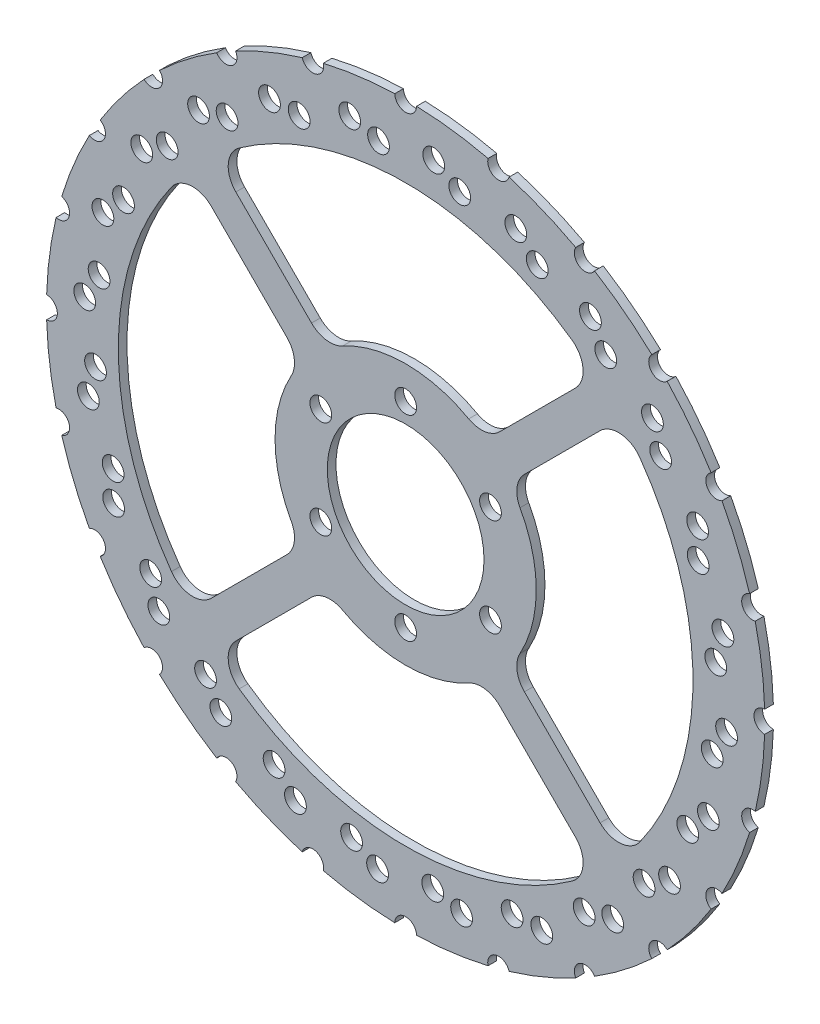
from build123d import *

# Parameters (mm, degrees)
SKETCH2_R                = 82.5
SKETCH2_R_2              = 18
BOSS_EXTRUDE1_DEPTH      = 2
SKETCH3_R                = 2.5
CUT_EXTRUDE1_DEPTH       = 117.689759619
CIRPATTERN1_COUNT        = 24
SKETCH4_R                = 2.5
CUT_EXTRUDE2_DEPTH       = 117.636198796
CIRPATTERN2_COUNT        = 6
CUT_EXTRUDE3_DEPTH       = 117.636198796
FILLET1_R                = 6
CIRPATTERN3_COUNT        = 4
FILLET1_OF_CIRPATTERN3_R = 6


with BuildPart() as part:
    # Sketch2 → Boss-Extrude1 (new body)
    with BuildSketch(Plane.XY):
        Circle(SKETCH2_R)
        Circle(SKETCH2_R_2, mode=Mode.SUBTRACT)
    extrude(amount=BOSS_EXTRUDE1_DEPTH)

    # Sketch3 → Cut-Extrude1 (cut, through all)
    with BuildSketch(Plane.XY):
        with Locations((0, 82.5)):
            Circle(SKETCH3_R)
        with Locations((6.449524963, 73.718407659)):
            Circle(SKETCH3_R)
        with Locations((12.415844703, 70.41375434)):
            Circle(SKETCH3_R)
    cut_extrude1 = extrude(amount=CUT_EXTRUDE1_DEPTH, mode=Mode.SUBTRACT)

    # CirPattern1: Cut-Extrude1 ×24 about axis
    cirpattern1_axis = Axis((0, 0, 0), (0, 0, 1))
    for i in range(1, CIRPATTERN1_COUNT):
        add(cut_extrude1.rotate(cirpattern1_axis, i * 360 / CIRPATTERN1_COUNT), mode=Mode.SUBTRACT)

    # Sketch4 → Cut-Extrude2 (cut, through all)
    with BuildSketch(Plane.XY.offset(2)):
        with Locations((0, 22.5)):
            Circle(SKETCH4_R)
    cut_extrude2 = extrude(amount=-CUT_EXTRUDE2_DEPTH, mode=Mode.SUBTRACT)

    # CirPattern2: Cut-Extrude2 ×6 about axis
    cirpattern2_axis = Axis((0, 0, 0), (0, 0, 1))
    for i in range(1, CIRPATTERN2_COUNT):
        add(cut_extrude2.rotate(cirpattern2_axis, i * 360 / CIRPATTERN2_COUNT), mode=Mode.SUBTRACT)

    # Sketch5 → Cut-Extrude3 (cut, through all)
    with BuildSketch(Plane.XY.offset(2)):
        with BuildLine():
            Line((-43.754831671, 49.41168592), (-18.195368917, 23.852223166))
            ThreePointArc((-18.195368917, 23.852223166), (0, 30), (18.195368917, 23.852223166))
            Line((18.195368917, 23.852223166), (43.754831671, 49.41168592))
            ThreePointArc((43.754831671, 49.41168592), (0, 66), (-43.754831671, 49.41168592))
        make_face()
    cut_extrude3 = extrude(amount=-CUT_EXTRUDE3_DEPTH, mode=Mode.SUBTRACT)

    # Fillet1
    fillet1_edges = [part.edges().sort_by_distance(p)[0] for p in [
        (-43.754831671, 49.41168592, 1),
        (43.754831671, 49.41168592, 1),
        (18.195368917, 23.852223166, 1),
        (-18.195368917, 23.852223166, 1),
    ]]
    fillet(fillet1_edges, radius=FILLET1_R)

    # CirPattern3: Cut-Extrude3 ×4 about axis
    cirpattern3_axis = Axis((0, 0, 0), (0, 0, 1))
    for i in range(1, CIRPATTERN3_COUNT):
        add(cut_extrude3.rotate(cirpattern3_axis, i * 360 / CIRPATTERN3_COUNT), mode=Mode.SUBTRACT)

    # Fillet1 of CirPattern3
    fillet1_of_cirpattern3_edges = [part.edges().sort_by_distance(p)[0] for p in [
        (-49.41168592, -43.754831671, 1),
        (-49.41168592, 43.754831671, 1),
        (-23.852223166, 18.195368917, 1),
        (-23.852223166, -18.195368917, 1),
        (43.754831671, -49.41168592, 1),
        (-43.754831671, -49.41168592, 1),
        (-18.195368917, -23.852223166, 1),
        (18.195368917, -23.852223166, 1),
        (49.41168592, 43.754831671, 1),
        (49.41168592, -43.754831671, 1),
        (23.852223166, -18.195368917, 1),
        (23.852223166, 18.195368917, 1),
    ]]
    fillet(fillet1_of_cirpattern3_edges, radius=FILLET1_OF_CIRPATTERN3_R)


solid = part.part
